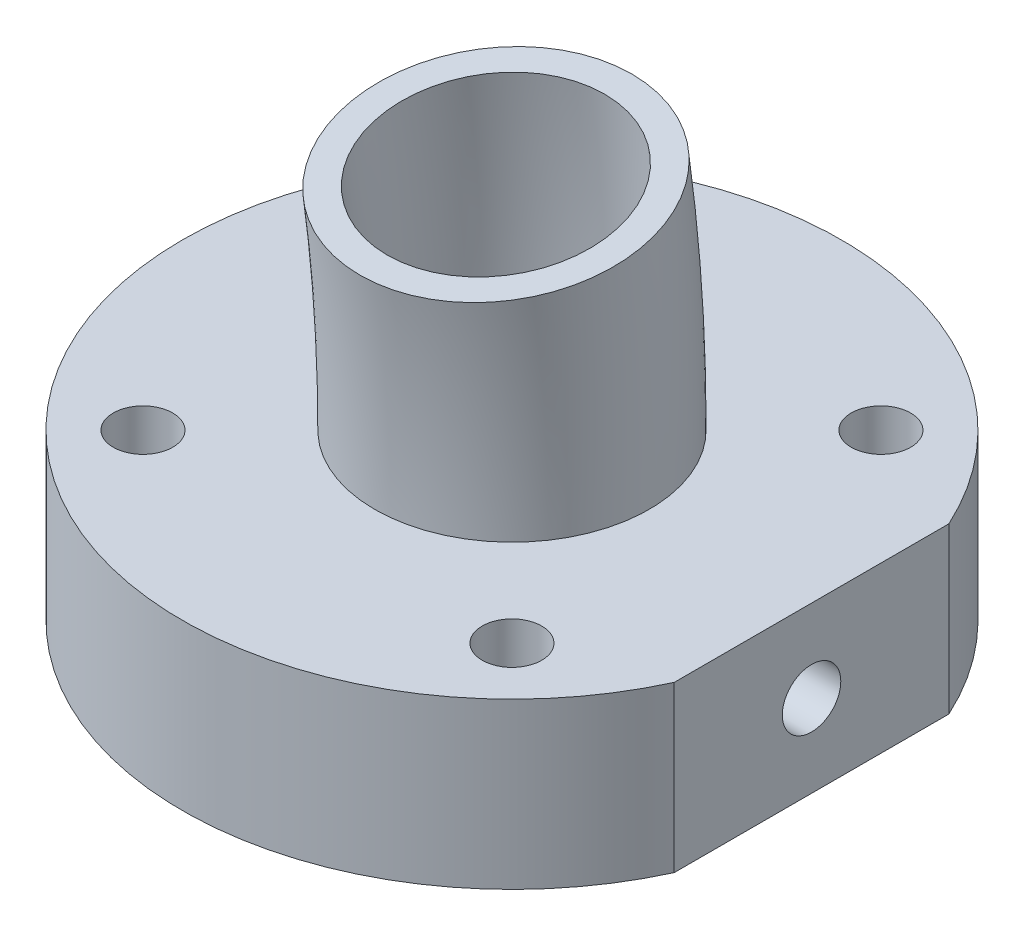
from build123d import *

# Parameters (mm, degrees)
SKETCH1_R                         = 30.48
MAIN_BODY_EXTRUDE_DEPTH           = 15.24
THROUGH_HOLE_FOR_BLOOD_DEPTH      = 46.72
THROUGH_HOLE_FOR_BLOOD_DEPTH_BACK = 46.72
SKETCH2_R                         = 10.16
M5_CLEARANCE_HOLE_D               = 5.5
SCREW_HOLE_PATTERN_COUNT          = 4
CUT_EXTRUDE2_DEPTH                = 46.72
SKETCH18_7_R                      = 2.5908
FLAT_SIDE_DOWEL_HOLE_DEPTH        = 3.81
SKETCH27_4_R                      = 2.54
FLAT_SIDE_DOWEL_DEPTH             = 3.81
CIRPATTERN1_COUNT                 = 2
CIRPATTERN2_COUNT                 = 2
SKETCH52_R                        = 12.7
SKETCH52_R_2                      = 10.16
REVOLVE2_ANGLE                    = 8
F_1_4_28_TAPPED_HOLE1_REACH       = 77.996
F_1_4_28_TAPPED_HOLE1_BORE_R      = 2.7051


with BuildPart() as part:
    # Sketch1 → Main Body Extrude (new body)
    with BuildSketch(Plane(origin=(0, 0, 0), x_dir=(1, 0, 0), z_dir=(0, 1, 0))):
        with Locations(Location((0, 0, 0), (0, 0, 90))):
            Circle(SKETCH1_R)
    extrude(amount=MAIN_BODY_EXTRUDE_DEPTH)

    # Sketch2 → Through Hole For Blood (cut, two sides: drawn at the far end of the back side and taken through both)
    with BuildSketch(Plane(origin=(0, 15.24, 0), x_dir=(1, 0, 0), z_dir=(0, 1, 0)).offset(-THROUGH_HOLE_FOR_BLOOD_DEPTH_BACK)):
        with Locations(Location((0, 0, 0), (0, 0, 270))):
            Circle(SKETCH2_R)
    extrude(amount=THROUGH_HOLE_FOR_BLOOD_DEPTH + THROUGH_HOLE_FOR_BLOOD_DEPTH_BACK, mode=Mode.SUBTRACT)

    # M5 Clearance Hole (through all)
    with Locations(Plane(origin=(0, 0, 0), x_dir=(-1, 0, 0), z_dir=(0, -1, 0))):
        with Locations((17.06248663, -17.06248663)):
            m5_clearance_hole = Hole(M5_CLEARANCE_HOLE_D / 2)

    # Screw Hole Pattern: M5 Clearance Hole ×4 about axis
    screw_hole_pattern_axis = Axis((0, 0, 0), (0, 1, 0))
    for i in range(1, SCREW_HOLE_PATTERN_COUNT):
        add(m5_clearance_hole.rotate(screw_hole_pattern_axis, i * 360 / SCREW_HOLE_PATTERN_COUNT), mode=Mode.SUBTRACT)

    # Sketch42 → Cut-Extrude2 (cut, through all)
    with BuildSketch(Plane.XZ):
        with BuildLine():
            Line((27.708128771, 12.7), (27.708128771, -12.7))
            ThreePointArc((27.708128771, -12.7), (30.48, 0), (27.708128771, 12.7))
        make_face()
    extrude(amount=-CUT_EXTRUDE2_DEPTH, mode=Mode.SUBTRACT)

    # Sketch18<7> → Flat Side Dowel Hole (cut)
    with BuildSketch(Plane(origin=(0, 0, 0), x_dir=(-1, 0, 0), z_dir=(0, -1, 0))):
        with Locations(Location((-21.741151963, 7.064128491, 0), (0, 0, 90))):
            Circle(SKETCH18_7_R)
    flat_side_dowel_hole = extrude(amount=-FLAT_SIDE_DOWEL_HOLE_DEPTH, mode=Mode.SUBTRACT)

    # Sketch27<4> → Flat Side Dowel (add)
    with BuildSketch(Plane.XZ):
        with Locations(Location((0, 22.86, 0), (0, 0, 90))):
            Circle(SKETCH27_4_R)
    flat_side_dowel = extrude(amount=FLAT_SIDE_DOWEL_DEPTH)

    # CirPattern1: Flat Side Dowel Hole ×2 about axis
    cirpattern1_axis = Axis((0, 0, 0), (0, 1, 0))
    for i in range(1, CIRPATTERN1_COUNT):
        add(flat_side_dowel_hole.rotate(cirpattern1_axis, i * 360 / CIRPATTERN1_COUNT), mode=Mode.SUBTRACT)

    # CirPattern2: Flat Side Dowel ×2 about axis
    cirpattern2_axis = Axis((0, 0, 0), (0, 1, 0))
    for i in range(1, CIRPATTERN2_COUNT):
        add(flat_side_dowel.rotate(cirpattern2_axis, i * 360 / CIRPATTERN2_COUNT))

    # Sketch52 → Revolve2 (revolve)
    with BuildSketch(Plane(origin=(0, 15.24, 0), x_dir=(1, 0, 0), z_dir=(0, 1, 0))):
        Circle(SKETCH52_R)
        with Locations(Location((0, 0, 0), (0, 0, 270))):
            Circle(SKETCH52_R_2, mode=Mode.SUBTRACT)
    revolve(axis=Axis((0, 15.24, 152.4), (1, 0, 0)), revolution_arc=REVOLVE2_ANGLE)

    # 1/4-28 Tapped Hole1 bore → 1/4-28 Tapped Hole1 (cut, up to next)
    with BuildSketch(Plane(origin=(27.708128771, 0, 0), x_dir=(0, 0, -1), z_dir=(1, 0, 0)), mode=Mode.PRIVATE) as f_1_4_28_tapped_hole1_sk1:
        with Locations((0, 7.62)):
            Circle(F_1_4_28_TAPPED_HOLE1_BORE_R)
    f_1_4_28_tapped_hole1_tool1 = extrude(f_1_4_28_tapped_hole1_sk1.sketch, amount=-F_1_4_28_TAPPED_HOLE1_REACH, mode=Mode.PRIVATE) & part.part
    add(f_1_4_28_tapped_hole1_tool1.solids().sort_by_distance((27.708129, 7.62, 0))[0], mode=Mode.SUBTRACT)


solid = part.part
